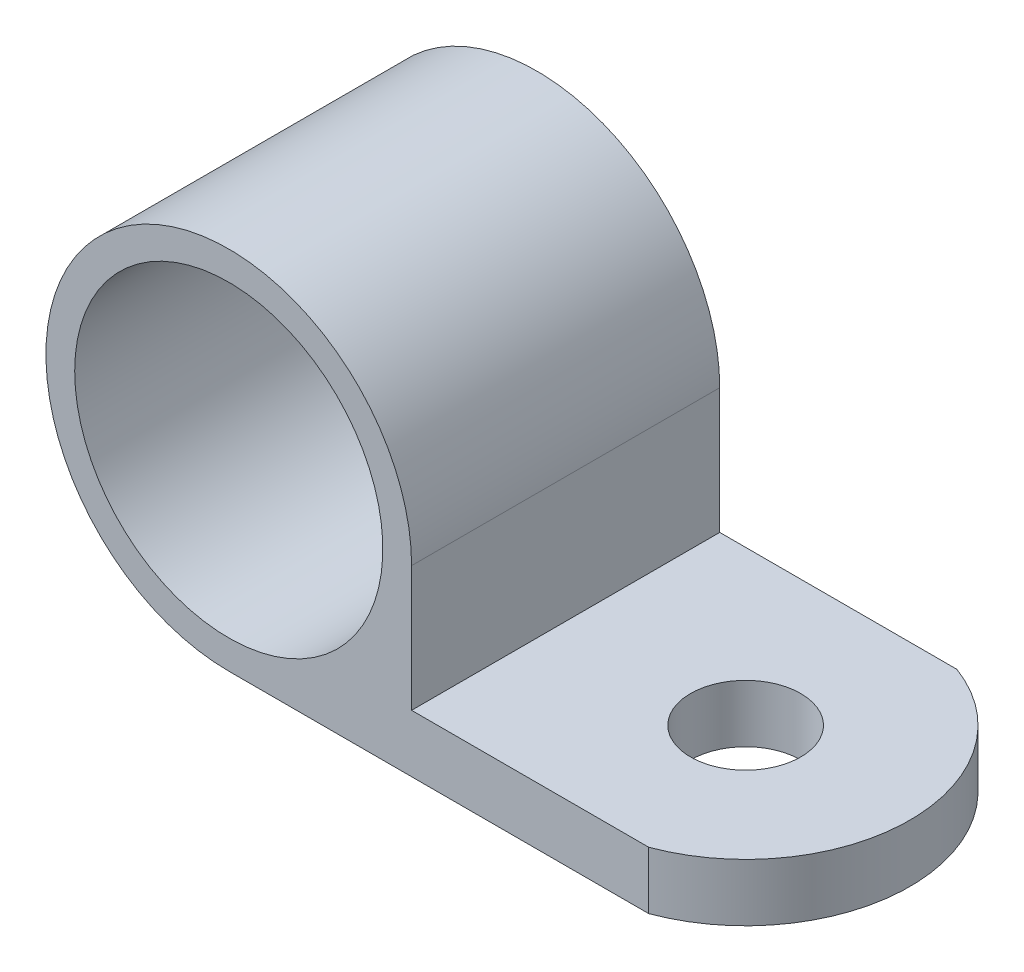
from build123d import *

# Parameters (mm, degrees)
SKETCH1_R           = 4.7625
BOSS_EXTRUDE1_DEPTH = 4.7625
SKETCH2_R           = 1.7018
CUT_EXTRUDE1_DEPTH  = 21.853960742


with BuildPart() as part:
    # Sketch1 → Boss-Extrude1 (new, symmetric)
    with BuildSketch(Plane.XY):
        with BuildLine():
            Line((6.35, 0), (-11.2141, 0))
            ThreePointArc((-11.2141, 0), (-15.210313974, 9.647713974), (-5.5626, 5.6515))
            Line((-5.5626, 5.6515), (-5.5626, 1.778))
            Line((-5.5626, 1.778), (6.35, 1.778))
            Line((6.35, 1.778), (6.35, 0))
        make_face()
        with Locations(Location((-11.2141, 5.6515, 0), (0, 0, 180))):
            Circle(SKETCH1_R, mode=Mode.SUBTRACT)
    extrude(amount=BOSS_EXTRUDE1_DEPTH, both=True)

    # Sketch2 → Cut-Extrude1 (cut, through all)
    with BuildSketch(Plane(origin=(0, 0, 0), x_dir=(1, 0, 0), z_dir=(0, 1, 0))):
        with Locations(Location((0, 0, 0), (0, 0, 90))):
            Circle(SKETCH2_R)
        with BuildLine():
            Line((0, -5.08), (0, -11.820740926))
            Line((0, -11.820740926), (11.381105031, -11.820740926))
            Line((11.381105031, -11.820740926), (11.381105031, 11.820740926))
            Line((11.381105031, 11.820740926), (0, 11.820740926))
            Line((0, 11.820740926), (0, 5.08))
            ThreePointArc((0, 5.08), (5.08, 0), (0, -5.08))
        make_face()
    extrude(amount=CUT_EXTRUDE1_DEPTH, mode=Mode.SUBTRACT)


solid = part.part
